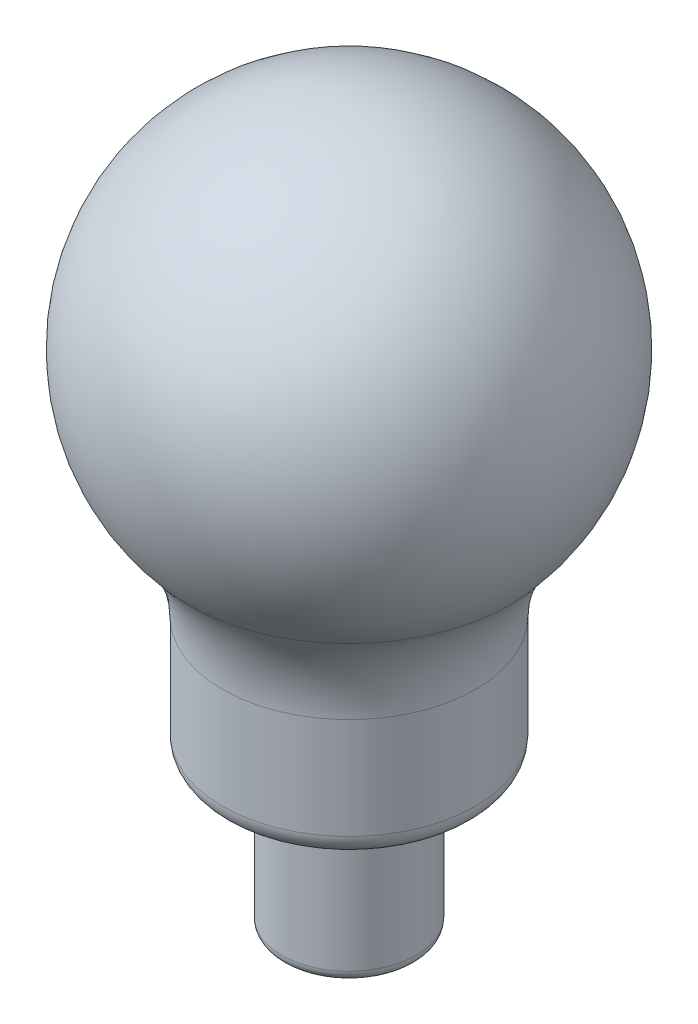
from build123d import *

# Parameters (mm, degrees)
SKETCH1_R                = 0.5
BOSS_EXTRUDE1_DEPTH      = 50
SKETCH2_R                = 0.5
BOSS_EXTRUDE2_DEPTH      = 50
BOSS_EXTRUDE3_DEPTH      = 7.7
BOSS_EXTRUDE3_DEPTH_BACK = 7.7
SKETCH3_R                = 0.048


with BuildPart() as part:
    # Sketch1 → Boss-Extrude1 (new body)
    with BuildSketch(Plane(origin=(0, 0, 0), x_dir=(1, 0, 0), z_dir=(0, 1, 0))):
        with Locations((7.5, 0)):
            Circle(SKETCH1_R)
    extrude(amount=BOSS_EXTRUDE1_DEPTH)



with BuildPart() as body_2:
    # Sketch2 → Boss-Extrude2 (new body)
    with BuildSketch(Plane(origin=(0, 0, 0), x_dir=(1, 0, 0), z_dir=(0, 1, 0))):
        with Locations((-7.5, 0)):
            Circle(SKETCH2_R)
    extrude(amount=BOSS_EXTRUDE2_DEPTH)


with BuildPart() as part_1:
    add(part.part)

    add(body_2.part)  # Boss-Extrude3 merges body 2
    # Sketch3 → Boss-Extrude3 (add, two sides: drawn at the far end of the back side and taken through both)
    with BuildSketch(Plane(origin=(0, 0, 0), x_dir=(0, 0, -1), z_dir=(1, 0, 0)).offset(-BOSS_EXTRUDE3_DEPTH_BACK)):
        with Locations((0, 49.097)):
            Circle(SKETCH3_R)
    extrude(amount=BOSS_EXTRUDE3_DEPTH + BOSS_EXTRUDE3_DEPTH_BACK)


with BuildPart() as body_2_2:
    # Sketch4 → Revolve1 (revolve)
    with BuildSketch(Plane.XY):
        with BuildLine():
            Line((-14.972842796, 9.941586391), (-9.973, 9.941586391))
            ThreePointArc((-9.973, 9.941586391), (-9.265893219, 9.648693172), (-8.973, 8.941586391))
            Line((-8.973, 8.941586391), (-8.973, -10.251281))
            ThreePointArc((-8.973, -10.251281), (-8.680106781, -10.958387781), (-7.973, -11.251281))
            Line((-7.973, -11.251281), (-7.973, -11.851281))
            ThreePointArc((-7.973, -11.851281), (-9.10437085, -11.38265185), (-9.573, -10.251281))
            Line((-9.573, -10.251281), (-9.573, 8.941586391))
            ThreePointArc((-9.573, 8.941586391), (-9.690157288, 9.224429103), (-9.973, 9.341586391))
            Line((-9.973, 9.341586391), (-14.972842796, 9.341586391))
            ThreePointArc((-14.972842796, 9.341586391), (-17.164873817, 10.249555369), (-18.072842796, 12.441586391))
            Line((-18.072842796, 12.441586391), (-18.072842796, 26.897340699))
            ThreePointArc((-18.072842796, 26.897340699), (-19.328620819, 33.763723215), (-22.933379791, 39.741172508))
            ThreePointArc((-22.933379791, 39.741172508), (-27.895161957, 72.578550766), (0, 90.6))
            Line((0, 90.6), (0, 90))
            ThreePointArc((0, 90), (-27.348197998, 72.331912515), (-22.483705677, 40.138404419))
            ThreePointArc((-22.483705677, 40.138404419), (-18.767459314, 33.976085561), (-17.472842796, 26.897340699))
            Line((-17.472842796, 26.897340699), (-17.472842796, 12.441586391))
            ThreePointArc((-17.472842796, 12.441586391), (-16.740609749, 10.673819438), (-14.972842796, 9.941586391))
        make_face()
    revolve(axis=Axis((0, 100, 0), (0, -1, 0)))


solid = Compound([part_1.part, body_2_2.part])
